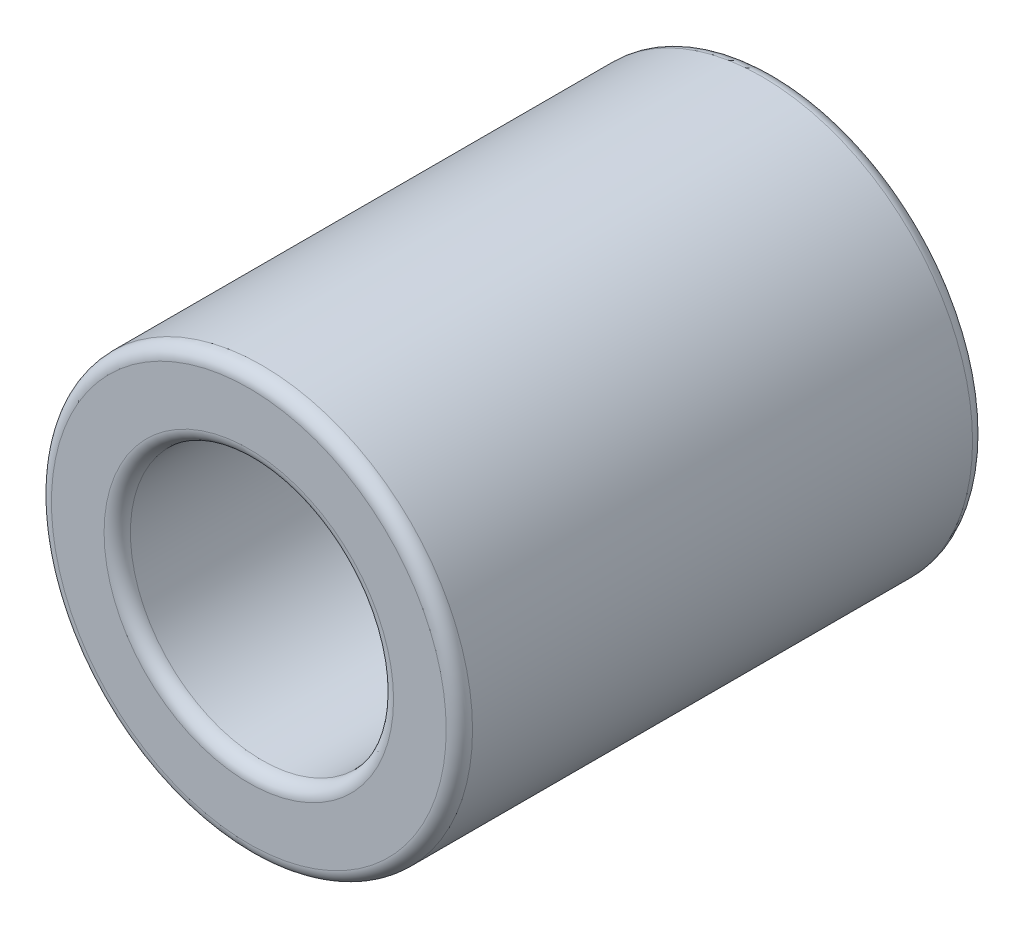
from build123d import *

# Parameters (mm, degrees)
SKETCH1_R           = 4
SKETCH1_R_2         = 2.5
BOSS_EXTRUDE1_DEPTH = 10
FILLET1_R           = 0.25


with BuildPart() as part:
    # Sketch1 → Boss-Extrude1 (new body)
    with BuildSketch(Plane.XY):
        Circle(SKETCH1_R)
        Circle(SKETCH1_R_2, mode=Mode.SUBTRACT)
    extrude(amount=BOSS_EXTRUDE1_DEPTH)

    # Fillet1
    fillet1_edges = [part.edges().sort_by_distance(p)[0] for p in [
        (-4, 0, 10),
        (-4, 0, 0),
        (-2.5, 0, 0),
        (-2.5, 0, 10),
    ]]
    fillet(fillet1_edges, radius=FILLET1_R)


solid = part.part
